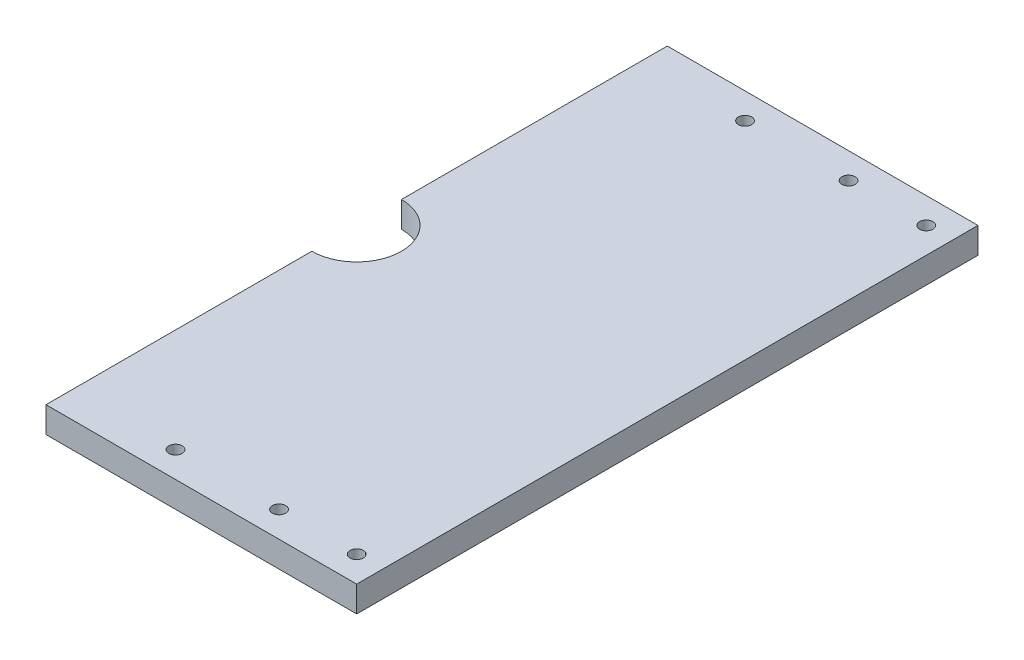
from build123d import *

# Parameters (mm, degrees)
SKETCH1_R           = 1.63195
BOSS_EXTRUDE1_DEPTH = 6.35


with BuildPart() as part:
    # Sketch1 → Boss-Extrude1 (new body)
    with BuildSketch(Plane(origin=(0, 0, 0), x_dir=(1, 0, 0), z_dir=(0, 1, 0))):
        with BuildLine():
            Line((0, -11), (0, -76.2))
            Line((0, -76.2), (76.22, -76.2))
            Line((76.22, -76.2), (76.22, 76.2))
            Line((76.22, 76.2), (0, 76.2))
            Line((0, 76.2), (0, 11))
            ThreePointArc((0, 11), (11, 0), (0, -11))
        make_face()
        with Locations(Location((69.87, 69.85, 0), (0, 0, 270))):
            Circle(SKETCH1_R, mode=Mode.SUBTRACT)
        with Locations(Location((69.87, -69.85, 0), (0, 0, 90))):
            Circle(SKETCH1_R, mode=Mode.SUBTRACT)
        with Locations(Location((50.82, 69.85, 0), (0, 0, 270))):
            Circle(SKETCH1_R, mode=Mode.SUBTRACT)
        with Locations(Location((25.42, 69.85, 0), (0, 0, 270))):
            Circle(SKETCH1_R, mode=Mode.SUBTRACT)
        with Locations(Location((50.82, -69.85, 0), (0, 0, 90))):
            Circle(SKETCH1_R, mode=Mode.SUBTRACT)
        with Locations(Location((25.42, -69.85, 0), (0, 0, 90))):
            Circle(SKETCH1_R, mode=Mode.SUBTRACT)
    extrude(amount=BOSS_EXTRUDE1_DEPTH)


solid = part.part
